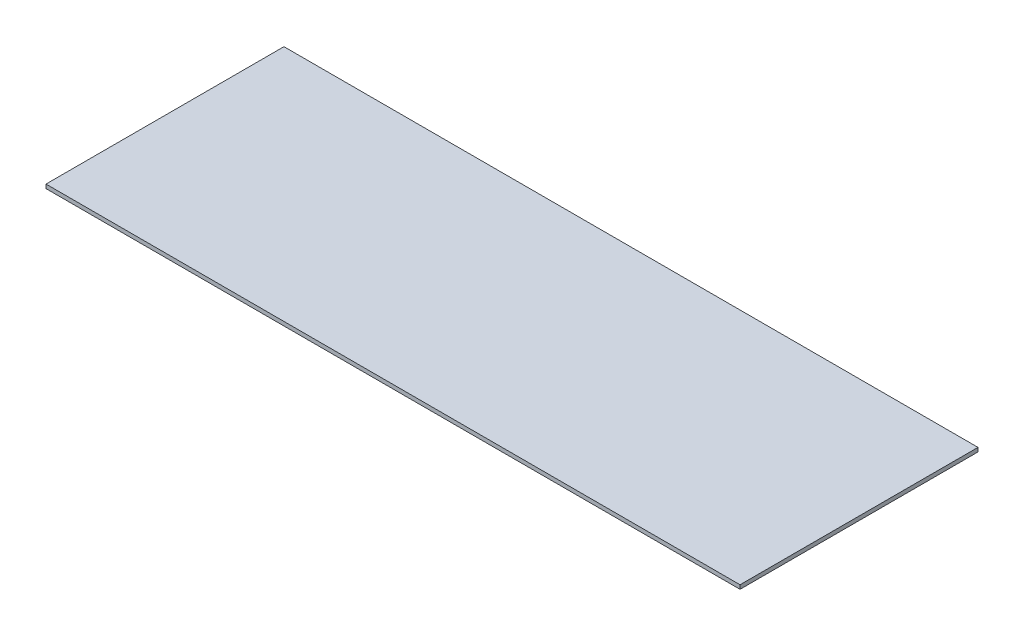
from build123d import *

# Parameters (mm, degrees)
SKETCH_2_W      = 350
SKETCH_2_H      = 120
EXTRUDE_2_DEPTH = 2


with BuildPart() as part:
    # 草图2 → 凸台-拉伸2 (new body)
    with BuildSketch(Plane(origin=(0, 0, 0), x_dir=(1, 0, 0), z_dir=(0, 1, 0))):
        with Locations((-17.808988764, 0.337078652)):
            Rectangle(SKETCH_2_W, SKETCH_2_H)
    extrude(amount=EXTRUDE_2_DEPTH)


solid = part.part
